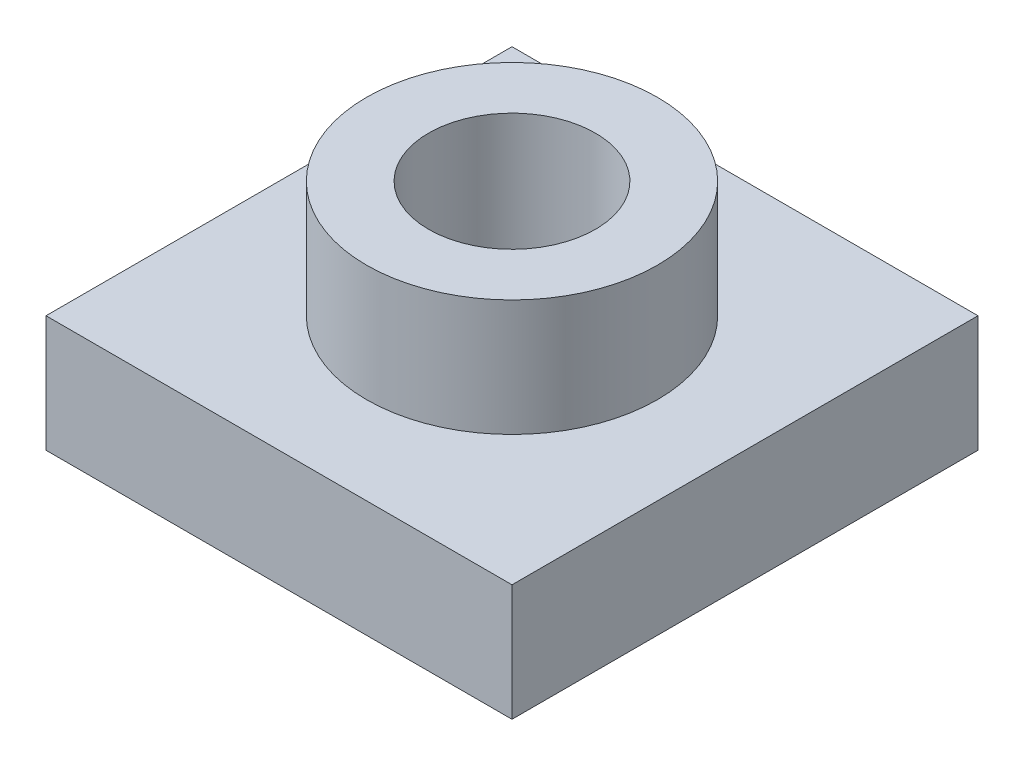
from build123d import *

# Parameters (mm, degrees)
SKETCH1_W           = 50
SKETCH1_H           = 50
BOSS_EXTRUDE1_DEPTH = 12.5
SKETCH2_R           = 15.605
SKETCH2_R_2         = 8.95
BOSS_EXTRUDE2_DEPTH = 12.5
SKETCH3_R           = 8.95
CUT_EXTRUDE1_DEPTH  = 76


with BuildPart() as part:
    # Sketch1 → Boss-Extrude1 (new body)
    with BuildSketch(Plane(origin=(0, 0, 0), x_dir=(1, 0, 0), z_dir=(0, 1, 0))):
        with Locations((25, 25)):
            Rectangle(SKETCH1_W, SKETCH1_H)
    extrude(amount=BOSS_EXTRUDE1_DEPTH)

    # Sketch2 → Boss-Extrude2 (add)
    with BuildSketch(Plane(origin=(0, 12.5, 0), x_dir=(1, 0, 0), z_dir=(0, 1, 0))):
        with Locations(Location((25, 25, 0), (0, 0, 90))):
            Circle(SKETCH2_R)
        with Locations(Location((25, 25, 0), (0, 0, 270))):
            Circle(SKETCH2_R_2, mode=Mode.SUBTRACT)
    extrude(amount=BOSS_EXTRUDE2_DEPTH)

    # Sketch3 → Cut-Extrude1 (cut, through all)
    with BuildSketch(Plane(origin=(0, 25, 0), x_dir=(1, 0, 0), z_dir=(0, 1, 0))):
        with Locations(Location((25, 25, 0), (0, 0, 270))):
            Circle(SKETCH3_R)
    extrude(amount=-CUT_EXTRUDE1_DEPTH, mode=Mode.SUBTRACT)


solid = part.part
